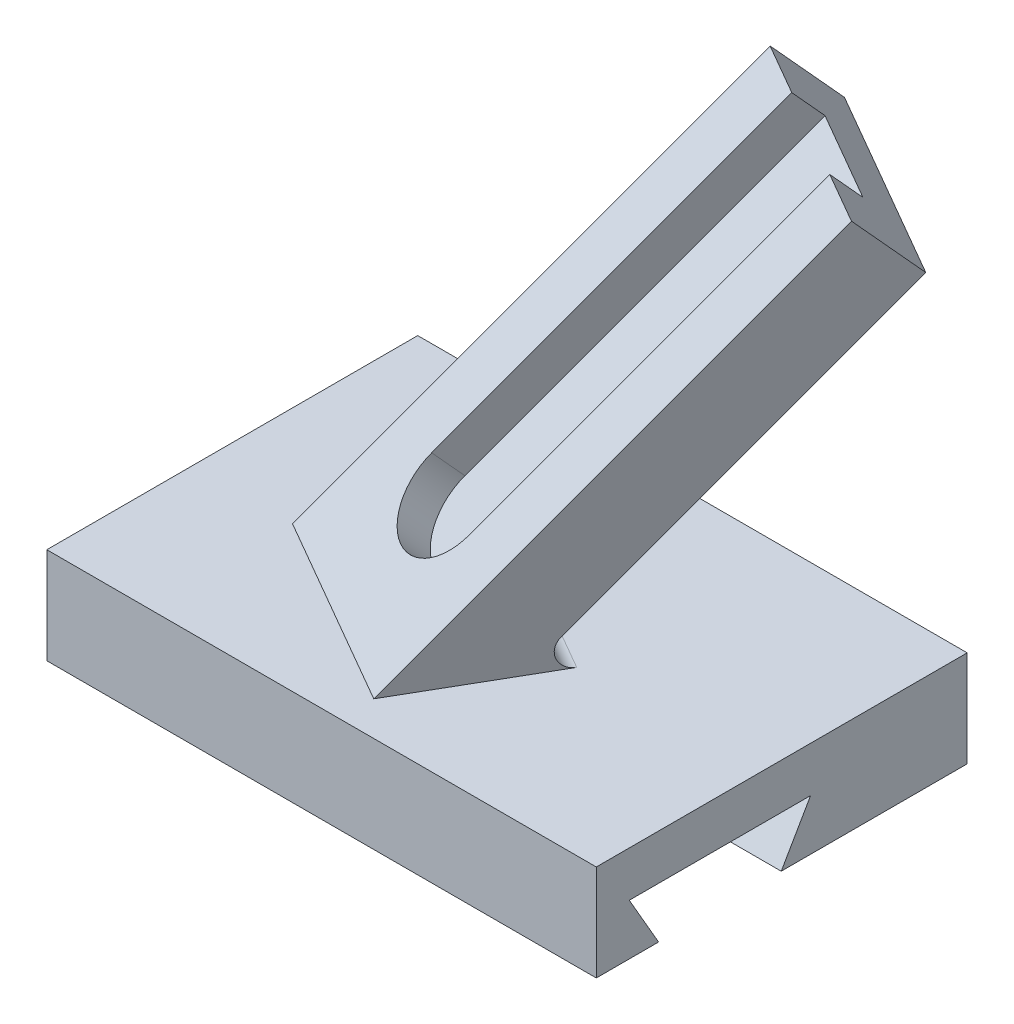
from build123d import *

# Parameters (mm, degrees)
CROQUIS1_W              = 101.6
CROQUIS1_H              = 68.58
SALIENTE_EXTRUIR1_DEPTH = 17.78
CROQUIS4_W              = 41.061151145
CROQUIS4_H              = 91.44
SALIENTE_EXTRUIR2_DEPTH = 14.224
CORTAR_EXTRUIR1_DEPTH   = 6.35
REDONDEO2_R             = 3.048
CORTAR_EXTRUIR2_DEPTH   = 160.707882909


with BuildPart() as part:
    # Croquis1 → Saliente-Extruir1 (new body)
    with BuildSketch(Plane(origin=(0, 0, 0), x_dir=(1, 0, 0), z_dir=(0, 1, 0))):
        with Locations((50.8, 34.29)):
            Rectangle(CROQUIS1_W, CROQUIS1_H)
    extrude(amount=SALIENTE_EXTRUIR1_DEPTH)

    # Croquis4 → Saliente-Extruir2 (add)
    with BuildSketch(Plane(origin=(3.692565329, -7.385130657, -6.395710759), x_dir=(-0.8660254037844416, 0, -0.49999999999999484), z_dir=(-0.3535533905932708, 0.7071067811865462, 0.6123724356957978))):
        with Locations((-23.148130824, -81.308869074)):
            Rectangle(CROQUIS4_W, CROQUIS4_H)
    extrude(amount=-SALIENTE_EXTRUIR2_DEPTH)

    # Croquis5 → Cortar-Extruir1 (cut)
    with BuildSketch(Plane(origin=(3.692565329, -7.385130657, -6.395710759), x_dir=(0.9354143466934866, 0.2672612419124214, 0.23145502494313694), z_dir=(-0.35355339059327084, 0.707106781186546, 0.612372435695798))):
        with BuildLine():
            Line((60.564352246, 112.481567013), (78.322456444, 105.231851332))
            Line((78.322456444, 105.231851332), (52.267557185, 41.410642848))
            ThreePointArc((52.267557185, 41.410642848), (39.763647245, 36.156448589), (34.509452987, 48.660358529))
            Line((34.509452987, 48.660358529), (60.564352246, 112.481567013))
        make_face()
    extrude(amount=-CORTAR_EXTRUIR1_DEPTH, mode=Mode.SUBTRACT)

    # Redondeo2
    redondeo2_edges = [part.edges().sort_by_distance(p)[0] for p in [
        (46.379886856, 17.78, -34.036058837),
    ]]
    fillet(redondeo2_edges, radius=REDONDEO2_R)

    # Croquis6 → Cortar-Extruir2 (cut, through all)
    with BuildSketch(Plane(origin=(101.6, 0, 0), x_dir=(0, 0, -1), z_dir=(1, 0, 0))):
        Polygon((6.096, 9.398), (39.624, 9.398), (34.19806217, 0), (11.52193783, 0), align=None)
    extrude(amount=-CORTAR_EXTRUIR2_DEPTH, mode=Mode.SUBTRACT)


solid = part.part
